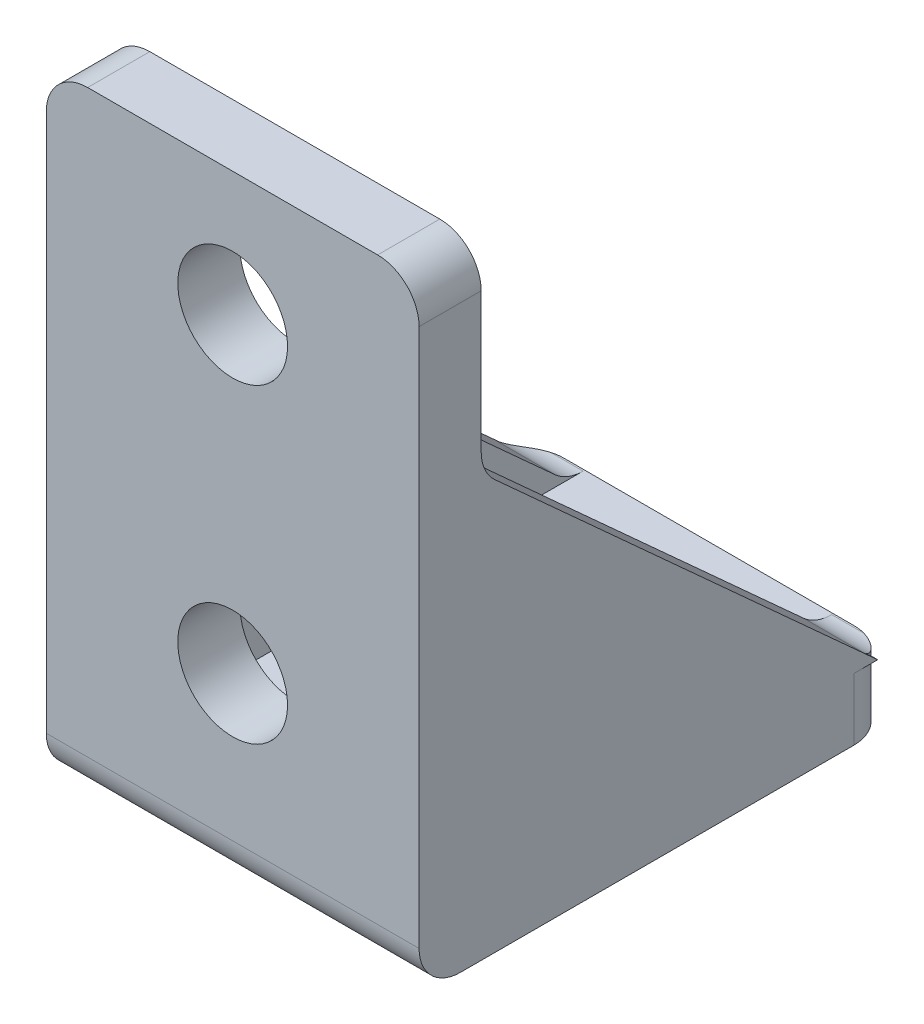
from build123d import *

# Parameters (mm, degrees)
SKETCH_1_W      = 18
SKETCH_1_H      = 30
SKETCH_1_R      = 2.65
EXTRUDE_1_DEPTH = 3
SKETCH_2_W      = 18
SKETCH_2_H      = 20
EXTRUDE_2_DEPTH = 3
FILLET_1_R      = 2
EXTRUDE_3_DEPTH = 3
EXTRUDE_4_DEPTH = 3
FILLET_2_R      = 2


with BuildPart() as part:
    # 草图1 → 凸台-拉伸1 (new body)
    with BuildSketch(Plane.XY):
        with Locations((9, -15)):
            Rectangle(SKETCH_1_W, SKETCH_1_H)
        with Locations((9, -6)):
            Circle(SKETCH_1_R, mode=Mode.SUBTRACT)
        with Locations((9, -21)):
            Circle(SKETCH_1_R, mode=Mode.SUBTRACT)
    extrude(amount=EXTRUDE_1_DEPTH)

    # 草图2 → 凸台-拉伸2 (add)
    with BuildSketch(Plane(origin=(0, -30, 0), x_dir=(-1, 0, 0), z_dir=(0, -1, 0))):
        with Locations((-9, 10)):
            Rectangle(SKETCH_2_W, SKETCH_2_H)
        with BuildLine():
            Line((-10.6, 6.025104147), (-10.6, 16.025104147))
            ThreePointArc((-10.6, 16.025104147), (-9, 17.625104147), (-7.4, 16.025104147))
            Line((-7.4, 16.025104147), (-7.4, 6.025104147))
            ThreePointArc((-7.4, 6.025104147), (-9, 4.425104147), (-10.6, 6.025104147))
        make_face(mode=Mode.SUBTRACT)
    extrude(amount=-EXTRUDE_2_DEPTH)

    # 圆角1
    fillet_1_edges = [part.edges().sort_by_distance(p)[0] for p in [
        (0, -28.5, -20),
        (18, -28.5, -20),
        (0, 0, 1.5),
        (18, 0, 1.5),
    ]]
    fillet(fillet_1_edges, radius=FILLET_1_R)

    # 草图3 → 凸台-拉伸3 (add)
    with BuildSketch(Plane.ZY):
        Polygon((0, -9.628512941), (-19.146125, -27), (0, -27), align=None)
    extrude(amount=-EXTRUDE_3_DEPTH)

    # 草图4 → 凸台-拉伸4 (add)
    with BuildSketch(Plane(origin=(18, 0, 0), x_dir=(0, 0, -1), z_dir=(1, 0, 0))):
        Polygon((0, -9.628512941), (19.146125, -27), (0, -27), align=None)
    extrude(amount=-EXTRUDE_4_DEPTH)

    # 圆角2
    fillet_2_edges = [part.edges().sort_by_distance(p)[0] for p in [
        (1.5, -9.628512941, 0),
        (1.680488334, -27, -19.146125),
        (16.319511666, -27, -19.146125),
        (16.5, -9.628512941, 0),
        (9, -30, 3),
    ]]
    fillet(fillet_2_edges, radius=FILLET_2_R)


solid = part.part
